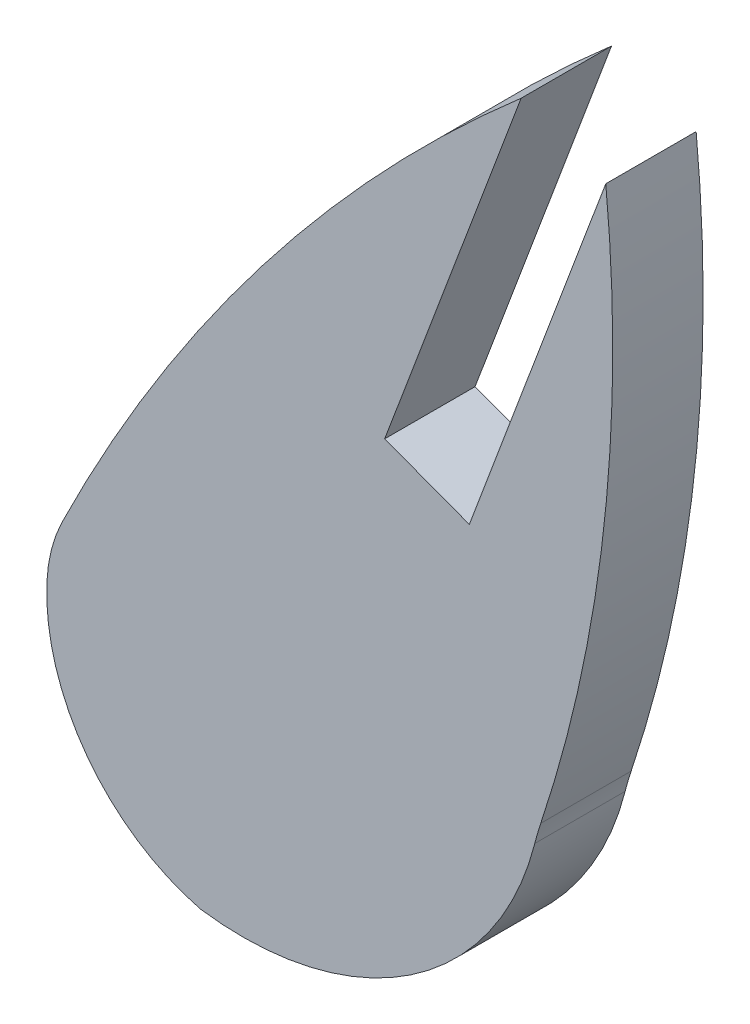
from build123d import *

# Parameters (mm, degrees)
BASE_EXTRUDE_DEPTH = 3


with BuildPart() as part:
    # Sketch1 → Base-Extrude (new body)
    with BuildSketch(Plane.XY):
        with BuildLine():
            Line((-834.83434342, -87.678972665), (-839.364460389, -99.73670996))
            Line((-839.364460389, -99.73670996), (-842.172799168, -98.681611242))
            Line((-842.172799168, -98.681611242), (-837.642682199, -86.623873947))
            ThreePointArc((-837.642682199, -86.623873947), (-846.255704387, -95.761021528), (-852.880224121, -106.428137137))
            ThreePointArc((-852.880224121, -106.428137137), (-853.236644942, -107.398112585), (-853.386054738, -108.420641256))
            ThreePointArc((-853.386054738, -108.420641256), (-852.048634424, -112.746509925), (-848.281496833, -115.258582218))
            ThreePointArc((-848.281496833, -115.258582218), (-841.313301936, -113.662818896), (-837.190944526, -107.822581735))
            ThreePointArc((-837.190944526, -107.822581735), (-837.097500446, -107.480758655), (-836.992003912, -107.142461011))
            ThreePointArc((-836.992003912, -107.142461011), (-834.889529289, -97.524194802), (-834.83434342, -87.678972665))
        make_face()
    extrude(amount=BASE_EXTRUDE_DEPTH)


solid = part.part
